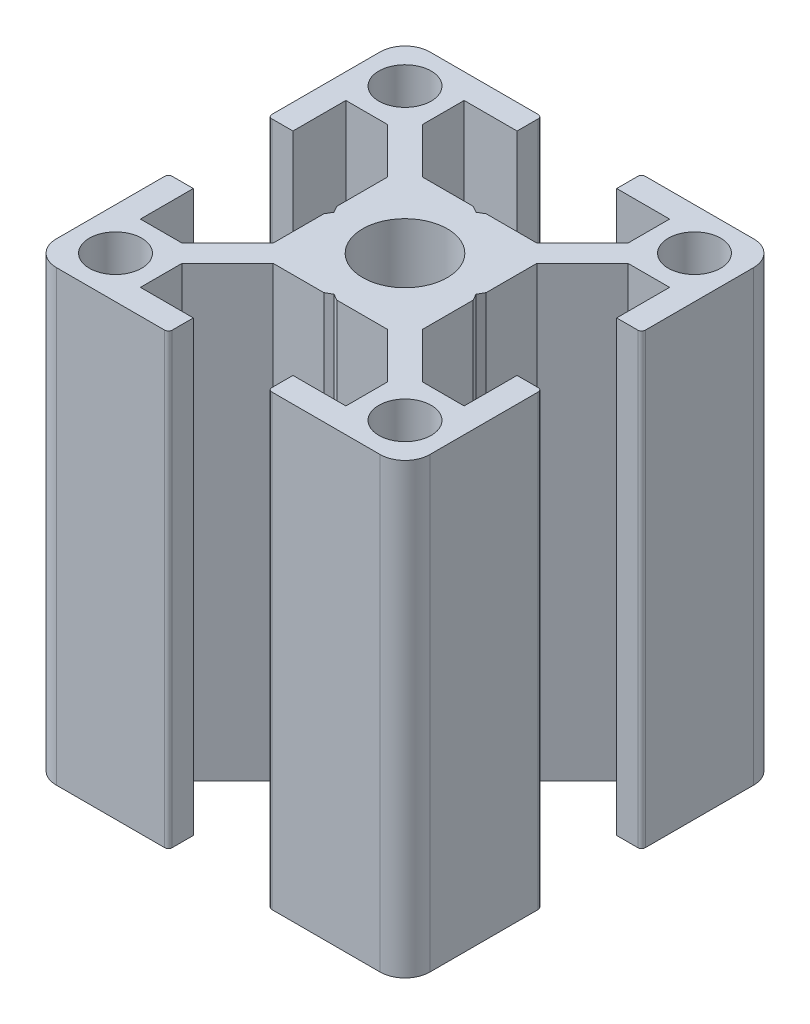
from build123d import *

# Parameters (mm, degrees)
MODEL_R                  = 2.1
MODEL_R_2                = 3.4
STRUCTURAL_MEMBER1_DEPTH = 36


with BuildPart() as part:
    # Model → Structural Member1 (new body)
    with BuildSketch(Plane(origin=(0, 0, 0), x_dir=(-1, 0, 0), z_dir=(0, 1, 0))):
        with BuildLine():
            Line((-15, 13), (-15, 4.3))
            ThreePointArc((-15, 4.3), (-14.912132034, 4.087867966), (-14.7, 4))
            Line((-14.7, 4), (-13, 4))
            Line((-13, 4), (-13, 8.25))
            Line((-13, 8.25), (-9.6642, 8.25))
            Line((-9.6642, 8.25), (-6, 4.5858))
            Line((-6, 4.5858), (-6, 0.519615242))
            Line((-6, 0.519615242), (-5.7, 0))
            Line((-5.7, 0), (-6, -0.519615242))
            Line((-6, -0.519615242), (-6, -4.5858))
            Line((-6, -4.5858), (-9.6642, -8.25))
            Line((-9.6642, -8.25), (-13, -8.25))
            Line((-13, -8.25), (-13, -4))
            Line((-13, -4), (-14.7, -4))
            ThreePointArc((-14.7, -4), (-14.912132034, -4.087867966), (-15, -4.3))
            Line((-15, -4.3), (-15, -13))
            ThreePointArc((-15, -13), (-14.414213562, -14.414213562), (-13, -15))
            Line((-13, -15), (-4.3, -15))
            ThreePointArc((-4.3, -15), (-4.087867966, -14.912132034), (-4, -14.7))
            Line((-4, -14.7), (-4, -13))
            Line((-4, -13), (-8.25, -13))
            Line((-8.25, -13), (-8.25, -9.6642))
            Line((-8.25, -9.6642), (-4.5858, -6))
            Line((-4.5858, -6), (-0.519615242, -6))
            Line((-0.519615242, -6), (0, -5.7))
            Line((0, -5.7), (0.519615242, -6))
            Line((0.519615242, -6), (4.5858, -6))
            Line((4.5858, -6), (8.25, -9.6642))
            Line((8.25, -9.6642), (8.25, -13))
            Line((8.25, -13), (4, -13))
            Line((4, -13), (4, -14.7))
            ThreePointArc((4, -14.7), (4.087867966, -14.912132034), (4.3, -15))
            Line((4.3, -15), (13, -15))
            ThreePointArc((13, -15), (14.414213562, -14.414213562), (15, -13))
            Line((15, -13), (15, -4.3))
            ThreePointArc((15, -4.3), (14.912132034, -4.087867966), (14.7, -4))
            Line((14.7, -4), (13, -4))
            Line((13, -4), (13, -8.25))
            Line((13, -8.25), (9.6642, -8.25))
            Line((9.6642, -8.25), (6, -4.5858))
            Line((6, -4.5858), (6, -0.519615242))
            Line((6, -0.519615242), (5.7, 0))
            Line((5.7, 0), (6, 0.519615242))
            Line((6, 0.519615242), (6, 4.5858))
            Line((6, 4.5858), (9.6642, 8.25))
            Line((9.6642, 8.25), (13, 8.25))
            Line((13, 8.25), (13, 4))
            Line((13, 4), (14.7, 4))
            ThreePointArc((14.7, 4), (14.912132034, 4.087867966), (15, 4.3))
            Line((15, 4.3), (15, 13))
            ThreePointArc((15, 13), (14.414213562, 14.414213562), (13, 15))
            Line((13, 15), (4.3, 15))
            ThreePointArc((4.3, 15), (4.087867966, 14.912132034), (4, 14.7))
            Line((4, 14.7), (4, 13))
            Line((4, 13), (8.25, 13))
            Line((8.25, 13), (8.25, 9.6642))
            Line((8.25, 9.6642), (4.5858, 6))
            Line((4.5858, 6), (0.519615242, 6))
            Line((0.519615242, 6), (0, 5.7))
            Line((0, 5.7), (-0.519615242, 6))
            Line((-0.519615242, 6), (-4.5858, 6))
            Line((-4.5858, 6), (-8.25, 9.6642))
            Line((-8.25, 9.6642), (-8.25, 13))
            Line((-8.25, 13), (-4, 13))
            Line((-4, 13), (-4, 14.7))
            ThreePointArc((-4, 14.7), (-4.087867966, 14.912132034), (-4.3, 15))
            Line((-4.3, 15), (-13, 15))
            ThreePointArc((-13, 15), (-14.414213562, 14.414213562), (-15, 13))
        make_face()
        with Locations((11.625, -11.625)):
            Circle(MODEL_R, mode=Mode.SUBTRACT)
        with Locations((11.625, 11.625)):
            Circle(MODEL_R, mode=Mode.SUBTRACT)
        Circle(MODEL_R_2, mode=Mode.SUBTRACT)
        with Locations((-11.625, -11.625)):
            Circle(MODEL_R, mode=Mode.SUBTRACT)
        with Locations((-11.625, 11.625)):
            Circle(MODEL_R, mode=Mode.SUBTRACT)
    extrude(amount=STRUCTURAL_MEMBER1_DEPTH)


solid = part.part
